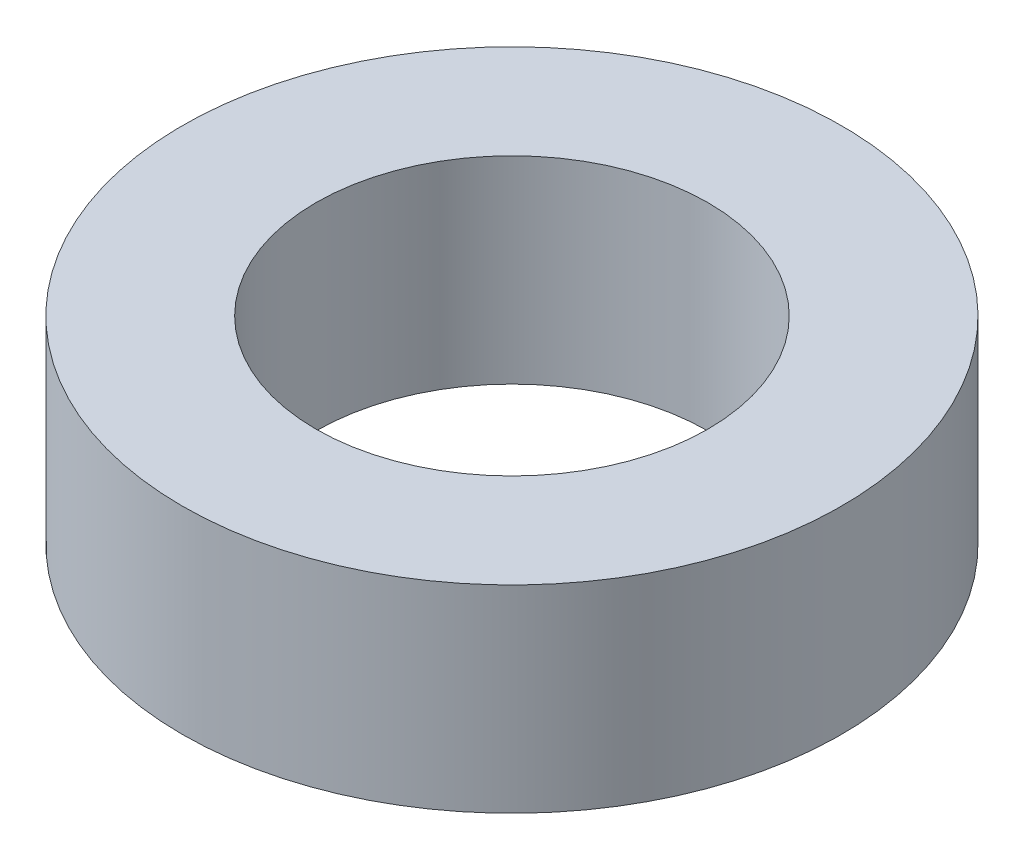
from build123d import *

# Parameters (mm, degrees)
SKETCH1_W = 4.05
SKETCH1_H = 6


with BuildPart() as part:
    # Sketch1 → Revolve1 (revolve)
    with BuildSketch(Plane(origin=(0, 0, 0), x_dir=(0, 0, -1), z_dir=(1, 0, 0))):
        with Locations((-7.975, 0)):
            Rectangle(SKETCH1_W, SKETCH1_H)
    revolve(axis=Axis((0, 16.257309942, 0), (0, -1, 0)))


solid = part.part
